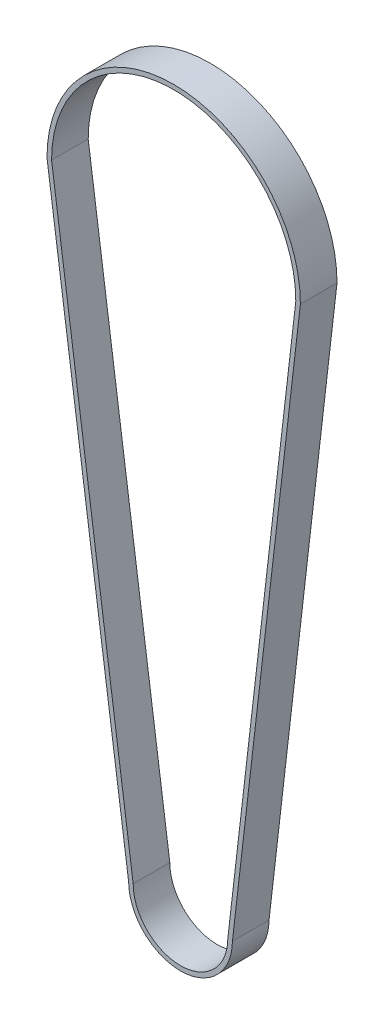
from build123d import *

# Parameters (mm, degrees)
BOSS_EXTRUDE1_DEPTH = 6


with BuildPart() as part:
    # Sketch2 → Boss-Extrude1 (new body)
    with BuildSketch(Plane.XY):
        with BuildLine():
            Line((-23.716099951, 46.699873921), (-10.34965482, -49.244363016))
            ThreePointArc((-10.34965482, -49.244363016), (-1.845412366, -57.691175485), (6.650062978, -49.23554545))
            Line((6.650062978, -49.23554545), (17.783787552, 46.708573322))
            ThreePointArc((17.783787552, 46.708573322), (-2.970515998, 67.502341581), (-23.716099951, 46.699873921))
        make_face()
        with BuildLine():
            Line((-22.966166286, 46.752342036), (-9.599821222, -49.191176628))
            ThreePointArc((-9.599821222, -49.191176628), (-1.849821222, -56.941176628), (5.900178778, -49.191176628))
            Line((5.900178778, -49.191176628), (17.033833714, 46.752342036))
            ThreePointArc((17.033833714, 46.752342036), (-2.966166286, 66.752342036), (-22.966166286, 46.752342036))
        make_face(mode=Mode.SUBTRACT)
    extrude(amount=BOSS_EXTRUDE1_DEPTH)


solid = part.part
